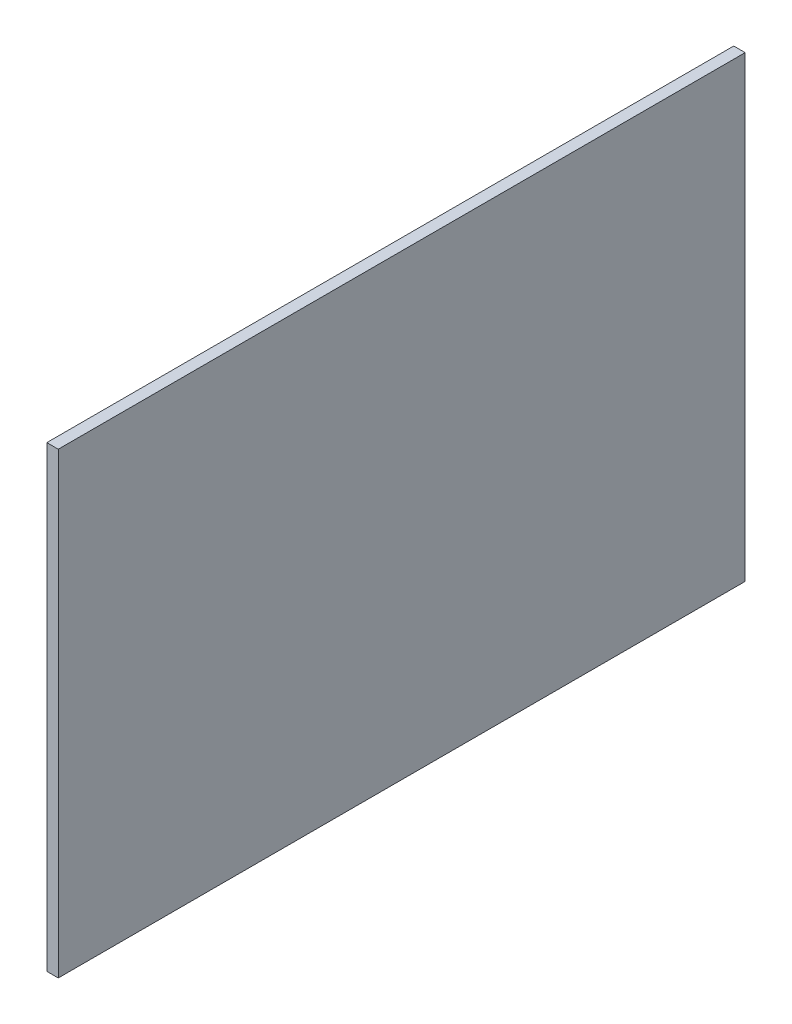
from build123d import *

# Parameters (mm, degrees)
SKETCH1_W           = 300
SKETCH1_H           = 200
BOSS_EXTRUDE1_DEPTH = 5
BOSS_EXTRUDE2_DEPTH = 5


with BuildPart() as part:
    # Sketch1 → Boss-Extrude1 (new body)
    with BuildSketch(Plane(origin=(0, 0, 0), x_dir=(0, 0, -1), z_dir=(1, 0, 0))):
        Rectangle(SKETCH1_W, SKETCH1_H)
    extrude(amount=BOSS_EXTRUDE1_DEPTH)

    # Sketch2 → Boss-Extrude2 (add)
    with BuildSketch(Plane.ZY):
        with BuildLine():
            Line((145, -85), (145, 85))
            ThreePointArc((145, 85), (142.071067812, 92.071067812), (135, 95))
            Line((135, 95), (-135, 95))
            ThreePointArc((-135, 95), (-142.071067812, 92.071067812), (-145, 85))
            Line((-145, 85), (-145, -85))
            ThreePointArc((-145, -85), (-142.071067812, -92.071067812), (-135, -95))
            Line((-135, -95), (135, -95))
            ThreePointArc((135, -95), (142.071067812, -92.071067812), (145, -85))
        make_face()
    extrude(amount=BOSS_EXTRUDE2_DEPTH)


solid = part.part
